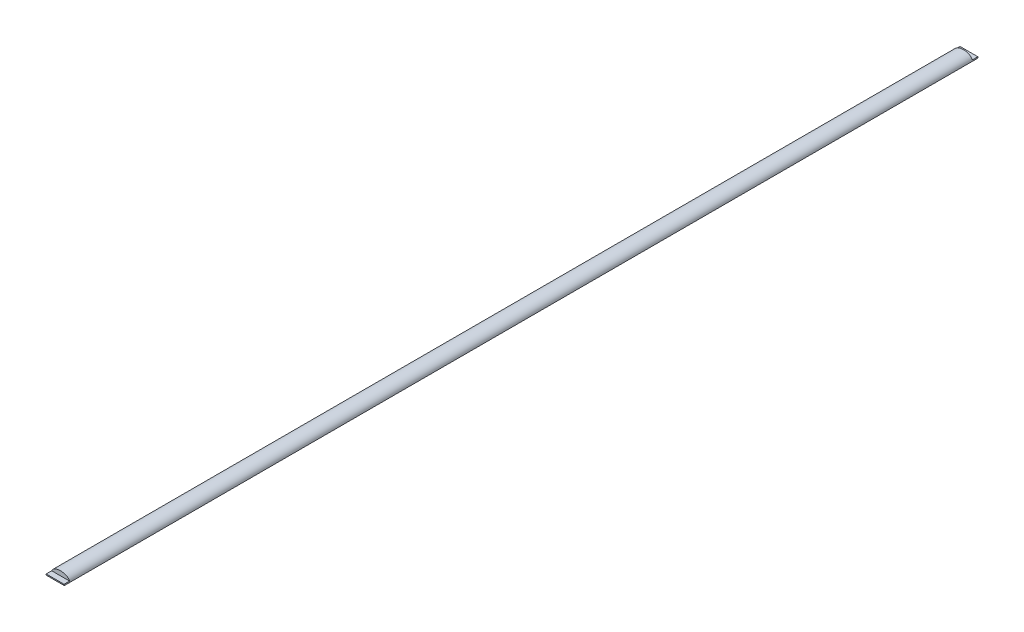
from build123d import *

# Parameters (mm, degrees)
BOSS_EXTRUDE1_DEPTH = 250
CUT_EXTRUDE1_DEPTH  = 3


with BuildPart() as part:
    # Sketch1 → Boss-Extrude1 (new, symmetric)
    with BuildSketch(Plane.XY):
        with BuildLine():
            Line((-5, 0), (5, 0))
            add(Edge.make_bspline(
                [(5, 0), (5, 3), (0, 3), (-5, 3), (-5, 0)],
                knots=[3.141592654, 3.141592654, 3.141592654, 4.71238898, 4.71238898, 6.283185307, 6.283185307, 6.283185307], degree=2, weights=[1, 0.707106781, 1, 0.707106781, 1]))
        make_face()
    extrude(amount=BOSS_EXTRUDE1_DEPTH, both=True)

    # Sketch2 → Cut-Extrude1 (cut)
    with BuildSketch(Plane.XY.offset(250)):
        with BuildLine():
            Line((-4.898979486, 0.6), (4.898979486, 0.6))
            add(Edge.make_bspline(
                [(4.898979486, 0.6), (4.082482905, 3), (0, 3), (-4.082482905, 3), (-4.898979486, 0.6)],
                knots=[3.356990684, 3.356990684, 3.356990684, 4.71238898, 4.71238898, 6.067787277, 6.067787277, 6.067787277], degree=2, weights=[0.930688033, 0.747270246, 1, 0.747270246, 0.930688033]))
        make_face()
    cut_extrude1 = extrude(amount=-CUT_EXTRUDE1_DEPTH, mode=Mode.SUBTRACT)

    # Mirror1: Cut-Extrude1 across plane
    add(cut_extrude1.mirror(Plane.XY), mode=Mode.SUBTRACT)


solid = part.part
